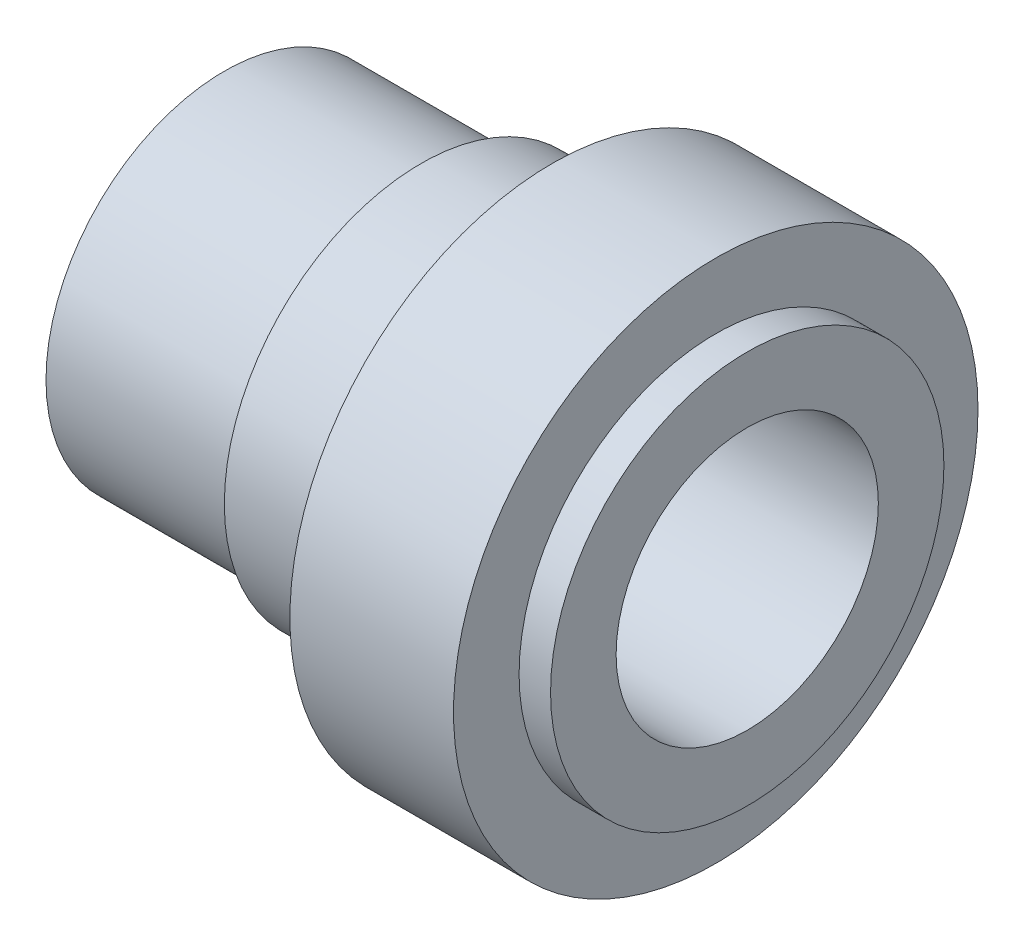
from build123d import *

# Parameters (mm, degrees)
SKETCH1_R           = 12.7
BOSS_EXTRUDE1_DEPTH = 7.9248
SKETCH2_R           = 9.525
BOSS_EXTRUDE2_DEPTH = 1.524
BOSS_EXTRUDE4_START = 6.35
SKETCH4_R           = 9.525
BOSS_EXTRUDE4_DEPTH = 6.35
SKETCH5_R           = 8.636
BOSS_EXTRUDE5_DEPTH = 9.525
SKETCH6_R           = 6.35
CUT_EXTRUDE1_DEPTH  = 25.4


with BuildPart() as part:
    # Sketch1 → Boss-Extrude1 (new body)
    with BuildSketch(Plane(origin=(0, 0, 0), x_dir=(0, 0, -1), z_dir=(1, 0, 0))):
        Circle(SKETCH1_R)
    extrude(amount=BOSS_EXTRUDE1_DEPTH)

    # Sketch2 → Boss-Extrude2 (add)
    with BuildSketch(Plane(origin=(7.9248, 0, 0), x_dir=(0, 0, -1), z_dir=(1, 0, 0))):
        with Locations(Location((0, 0, 0), (0, 0, 180))):
            Circle(SKETCH2_R)
    extrude(amount=BOSS_EXTRUDE2_DEPTH)

    # Sketch4 → Boss-Extrude4 (add)
    with BuildSketch(Plane.ZY.offset(BOSS_EXTRUDE4_START)):
        Circle(SKETCH4_R)
    extrude(amount=-BOSS_EXTRUDE4_DEPTH)

    # Sketch5 → Boss-Extrude5 (add)
    with BuildSketch(Plane.ZY.offset(6.35)):
        with Locations(Location((0, 0, 0), (0, 0, 180))):
            Circle(SKETCH5_R)
    extrude(amount=BOSS_EXTRUDE5_DEPTH)

    # Sketch6 → Cut-Extrude1 (cut)
    with BuildSketch(Plane.ZY.offset(15.875)):
        Circle(SKETCH6_R)
    extrude(amount=-CUT_EXTRUDE1_DEPTH, mode=Mode.SUBTRACT)


solid = part.part
